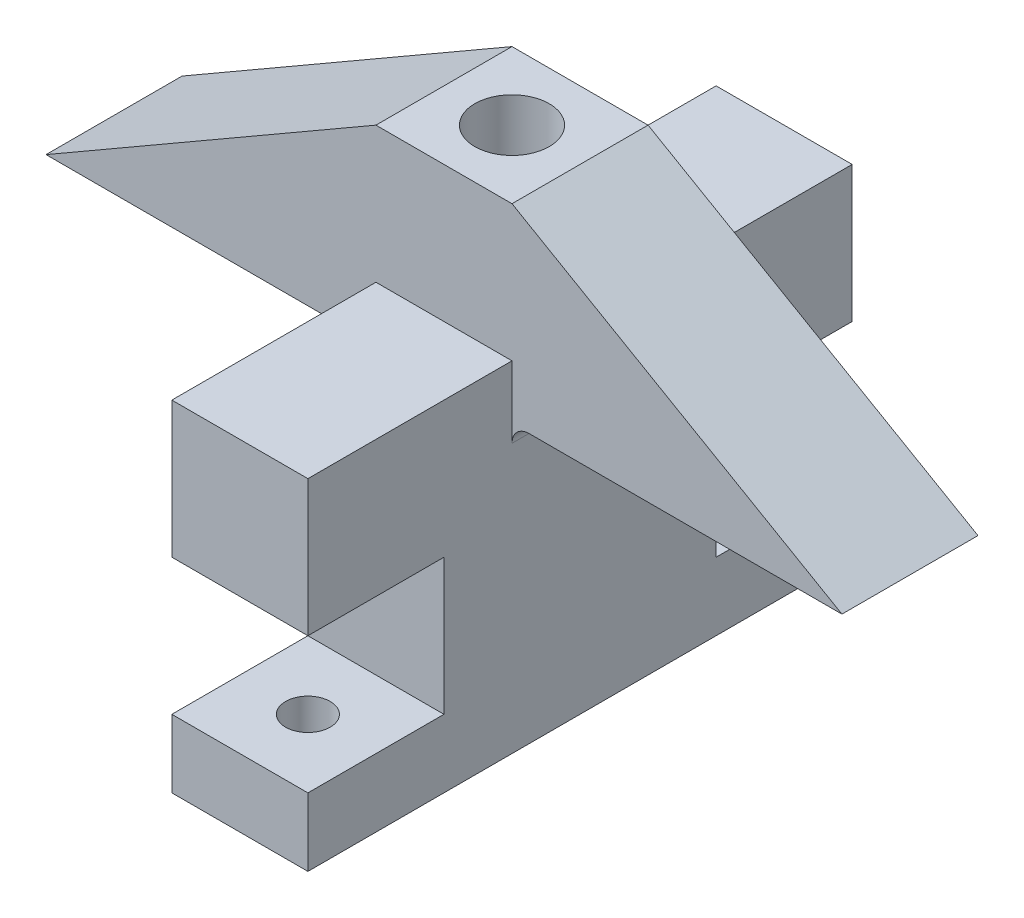
from build123d import *

# Parameters (mm, degrees)
BOSS_EXTRUDE1_DEPTH        = 25.4
SKETCH2_W                  = 25.4
SKETCH2_H                  = 12.7
BOSS_EXTRUDE2_DEPTH        = 38.1
SKETCH3_W                  = 25.4
SKETCH3_H                  = 12.7
BOSS_EXTRUDE3_DEPTH        = 38.1
F_0_328IN_DOWEL_HOLE1_D    = 8.3312
F_0_55IN_DOWEL_HOLE2_D     = 13.8938
F_0_55IN_DOWEL_HOLE2_DEPTH = 35.052
F_0_55IN_DOWEL_HOLE2_TIP   = 4.174118634
FILLET1_R                  = 3.175
SKETCH8_W                  = 25.4
SKETCH8_H                  = 25.4
BOSS_EXTRUDE4_DEPTH        = 12.7
BOSS_EXTRUDE5_DEPTH        = 38.1
SKETCH9_W                  = 25.4
SKETCH9_H                  = 25.4
BOSS_EXTRUDE6_DEPTH        = 12.7
BOSS_EXTRUDE7_DEPTH        = 38.1


with BuildPart() as part:
    # Sketch1 → Boss-Extrude1 (new body)
    with BuildSketch(Plane.XY):
        Polygon((0, 0), (0, 53.34), (-61.591726717, 53.34), (0, 88.9), (25.4, 88.9), (86.991726717, 53.34), (25.4, 53.34), (25.4, 0), align=None)
    extrude(amount=BOSS_EXTRUDE1_DEPTH)

    # Sketch2 → Boss-Extrude2 (add)
    with BuildSketch(Plane.XY.offset(25.4)):
        with Locations((12.7, 6.35)):
            Rectangle(SKETCH2_W, SKETCH2_H)
    extrude(amount=BOSS_EXTRUDE2_DEPTH)

    # Sketch3 → Boss-Extrude3 (add)
    with BuildSketch(Plane(origin=(0, 0, 0), x_dir=(-1, 0, 0), z_dir=(0, 0, -1))):
        with Locations((-12.7, 6.35)):
            Rectangle(SKETCH3_W, SKETCH3_H)
    extrude(amount=BOSS_EXTRUDE3_DEPTH)

    # Ø0.328in Dowel Hole1 (through all)
    with Locations(Plane(origin=(0, 12.7, 0), x_dir=(1, 0, 0), z_dir=(0, 1, 0))):
        with Locations((12.7, 25.4), (12.7, -50.8)):
            Hole(F_0_328IN_DOWEL_HOLE1_D / 2)

    # Ø0.55in Dowel Hole2
    with Locations(Plane(origin=(0, 88.9, 0), x_dir=(1, 0, 0), z_dir=(0, 1, 0))):
        with Locations((12.7, -12.7)):
            Hole(F_0_55IN_DOWEL_HOLE2_D / 2, depth=F_0_55IN_DOWEL_HOLE2_DEPTH)
            with Locations((0, 0, -(F_0_55IN_DOWEL_HOLE2_DEPTH + F_0_55IN_DOWEL_HOLE2_TIP / 2))):  # 118° drill point
                Cone(0, F_0_55IN_DOWEL_HOLE2_D / 2, F_0_55IN_DOWEL_HOLE2_TIP, mode=Mode.SUBTRACT)

    # Fillet1
    fillet1_edges = [part.edges().sort_by_distance(p)[0] for p in [
        (25.4, 53.34, 12.7),
        (0, 53.34, 12.7),
    ]]
    fillet(fillet1_edges, radius=FILLET1_R)

    # Sketch8 → Boss-Extrude4 (add)
    with BuildSketch(Plane.XY.offset(25.4)):
        with Locations((12.7, 25.4)):
            Rectangle(SKETCH8_W, SKETCH8_H)
    extrude(amount=BOSS_EXTRUDE4_DEPTH)

    # Sketch8<3> → Boss-Extrude5 (add)
    with BuildSketch(Plane.XY.offset(25.4)):
        Polygon((0, 50.165), (0, 38.1), (25.4, 38.1), (25.4, 63.5), (0, 63.5), align=None)
    extrude(amount=BOSS_EXTRUDE5_DEPTH)

    # Sketch9 → Boss-Extrude6 (add)
    with BuildSketch(Plane(origin=(0, 0, 0), x_dir=(-1, 0, 0), z_dir=(0, 0, -1))):
        with Locations((-12.7, 25.4)):
            Rectangle(SKETCH9_W, SKETCH9_H)
    extrude(amount=BOSS_EXTRUDE6_DEPTH)

    # Sketch9<3> → Boss-Extrude7 (add)
    with BuildSketch(Plane(origin=(0, 0, 0), x_dir=(-1, 0, 0), z_dir=(0, 0, -1))):
        Polygon((-25.4, 50.165), (-25.4, 38.1), (0, 38.1), (0, 50.165), (0, 63.5), (-25.4, 63.5), align=None)
    extrude(amount=BOSS_EXTRUDE7_DEPTH)


solid = part.part
